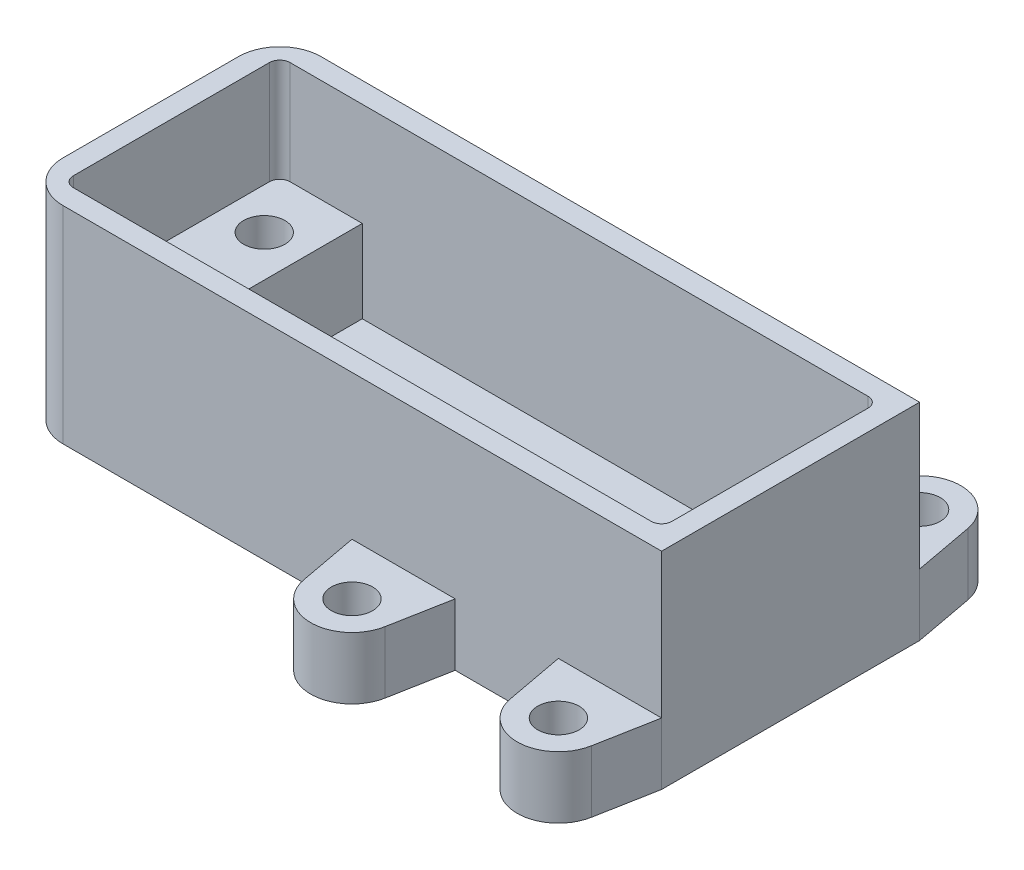
from build123d import *

# Parameters (mm, degrees)
SKETCH_1_W          = 62
SKETCH_1_H          = 25
EXTRUDE_1_DEPTH     = 20
SHELL_1_T           = -2
SKETCH_2_W          = 8
SKETCH_2_H          = 21
EXTRUDE_2_DEPTH     = 8
SKETCH_3_R          = 2
CUT_EXTRUDE_1_DEPTH = 35.889110049
SKETCH_4_R          = 6
CUT_EXTRUDE_2_DEPTH = 38.963798545
SKETCH_5_R          = 2
EXTRUDE_3_DEPTH     = 6
FILLET_1_R          = 4
FILLET_2_R          = 1


with BuildPart() as part:
    # 草图1 → 凸台-拉伸1 (new body)
    with BuildSketch(Plane(origin=(0, 0, 0), x_dir=(1, 0, 0), z_dir=(0, 1, 0))):
        Rectangle(SKETCH_1_W, SKETCH_1_H)
    extrude(amount=EXTRUDE_1_DEPTH)

    # 抽壳1
    shell_1_openings = [part.faces().sort_by_distance(p)[0] for p in [
        (0, 20, 0),
    ]]
    offset(amount=SHELL_1_T, openings=shell_1_openings, kind=Kind.INTERSECTION)

    # 草图2 → 凸台-拉伸2 (add)
    with BuildSketch(Plane(origin=(0, 2, 0), x_dir=(1, 0, 0), z_dir=(0, 1, 0))):
        with Locations((-25, 0)):
            Rectangle(SKETCH_2_W, SKETCH_2_H)
        with Locations((25, 0)):
            Rectangle(SKETCH_2_W, SKETCH_2_H)
    extrude(amount=EXTRUDE_2_DEPTH)

    # 草图3 → 切除-拉伸1 (cut, through all)
    with BuildSketch(Plane(origin=(0, 10, 0), x_dir=(1, 0, 0), z_dir=(0, 1, 0))):
        with Locations(Location((-25, 5, 0), (0, 0, 270))):
            Circle(SKETCH_3_R)
        with Locations(Location((-25, -5, 0), (0, 0, 270))):
            Circle(SKETCH_3_R)
        with Locations(Location((25, 5, 0), (0, 0, 270))):
            Circle(SKETCH_3_R)
        with Locations(Location((25, -5, 0), (0, 0, 270))):
            Circle(SKETCH_3_R)
    extrude(amount=-CUT_EXTRUDE_1_DEPTH, mode=Mode.SUBTRACT)

    # 草图4 → 切除-拉伸2 (cut, through all)
    with BuildSketch(Plane(origin=(0, 2, 0), x_dir=(1, 0, 0), z_dir=(0, 1, 0))):
        with Locations(Location((-12, 0, 0), (0, 0, 270))):
            Circle(SKETCH_4_R)
    extrude(amount=-CUT_EXTRUDE_2_DEPTH, mode=Mode.SUBTRACT)

    # 草图5 → 凸台-拉伸3 (add)
    # profile 1 of 2: a face of its own
    with BuildSketch(Plane(origin=(0, 0, 0), x_dir=(1, 0, 0), z_dir=(0, 1, 0))):
        with BuildLine():
            Line((22.067619242, 18.232380758), (21, 12.5))
            Line((21, 12.5), (31, 12.5))
            Line((31, 12.5), (29.932380758, 18.232380758))
            ThreePointArc((29.932380758, 18.232380758), (26, 21.5), (22.067619242, 18.232380758))
        make_face()
        with Locations(Location((26, 17.5, 0), (0, 0, 270))):
            Circle(SKETCH_5_R, mode=Mode.SUBTRACT)
    # profile 2 of 2: a face of its own
    with BuildSketch(Plane(origin=(0, 0, 0), x_dir=(1, 0, 0), z_dir=(0, 1, 0))):
        with BuildLine():
            Line((2.067619242, 18.232380758), (1, 12.5))
            Line((1, 12.5), (11, 12.5))
            Line((11, 12.5), (9.932380758, 18.232380758))
            ThreePointArc((9.932380758, 18.232380758), (6, 21.5), (2.067619242, 18.232380758))
        make_face()
        with Locations(Location((6, 17.5, 0), (0, 0, 270))):
            Circle(SKETCH_5_R, mode=Mode.SUBTRACT)
    extrude_3 = extrude(amount=EXTRUDE_3_DEPTH)

    # 镜向1: 凸台-拉伸3 across plane
    add(extrude_3.mirror(Plane.XY))

    # 圆角1
    fillet_1_edges = [part.edges().sort_by_distance(p)[0] for p in [
        (-31, 10, 12.5),
        (-31, 10, -12.5),
    ]]
    fillet(fillet_1_edges, radius=FILLET_1_R)

    # 圆角2
    fillet_2_edges = [part.edges().sort_by_distance(p)[0] for p in [
        (29, 15, 10.5),
        (29, 15, -10.5),
        (-29, 15, -10.5),
        (-29, 15, 10.5),
    ]]
    fillet(fillet_2_edges, radius=FILLET_2_R)


solid = part.part
